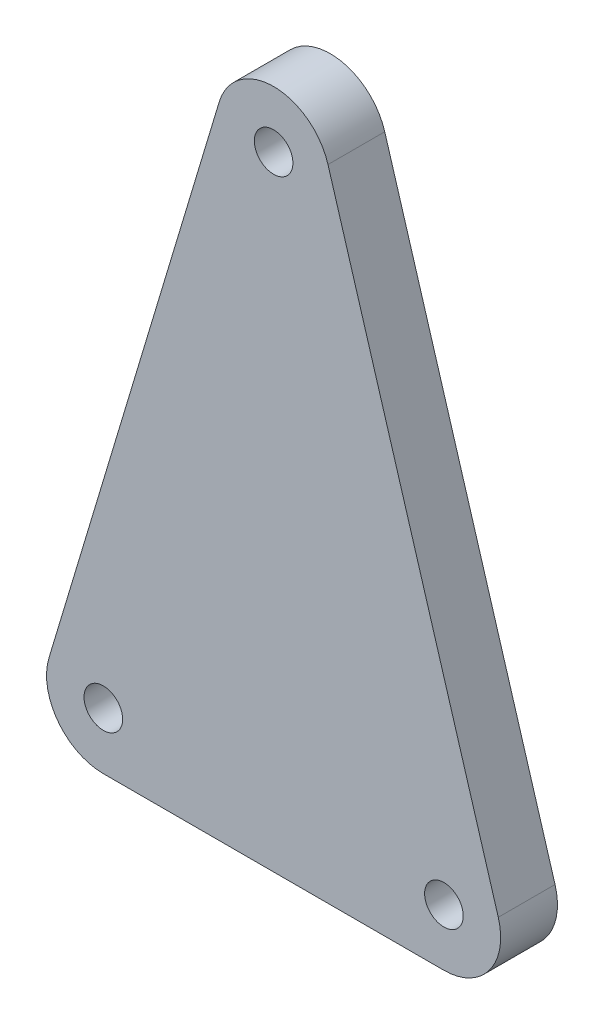
from build123d import *

# Parameters (mm, degrees)
BOSS_EXTRUDE1_DEPTH                             = 5
CSK_FOR_M3_FLAT_HEAD_MACHINE_SCREW2_D           = 3.4
CSK_FOR_M3_FLAT_HEAD_MACHINE_SCREW2_CSINK_D     = 6.3
CSK_FOR_M3_FLAT_HEAD_MACHINE_SCREW2_CSINK_ANGLE = 90


with BuildPart() as part:
    # Sketch1 → Boss-Extrude1 (new body)
    with BuildSketch(Plane.XY):
        with BuildLine():
            Line((4.788497338, 51.358851364), (19.788497338, 1.438851364))
            ThreePointArc((19.788497338, 1.438851364), (19.012122681, -2.983768019), (15, -5))
            Line((15, -5), (-15, -5))
            ThreePointArc((-15, -5), (-19.012122681, -2.983768019), (-19.788497338, 1.438851364))
            Line((-19.788497338, 1.438851364), (-4.788497338, 51.358851364))
            ThreePointArc((-4.788497338, 51.358851364), (0, 54.92), (4.788497338, 51.358851364))
        make_face()
    extrude(amount=BOSS_EXTRUDE1_DEPTH)

    # CSK for M3 Flat Head Machine Screw2 (through all)
    with Locations(Plane(origin=(-15, 0, 0), x_dir=(-1, 0, 0), z_dir=(0, 0, -1))):
        with Locations((0, 0), (-15, 49.92), (-30, 0)):
            CounterSinkHole(CSK_FOR_M3_FLAT_HEAD_MACHINE_SCREW2_D / 2, CSK_FOR_M3_FLAT_HEAD_MACHINE_SCREW2_CSINK_D / 2, counter_sink_angle=CSK_FOR_M3_FLAT_HEAD_MACHINE_SCREW2_CSINK_ANGLE)


solid = part.part
